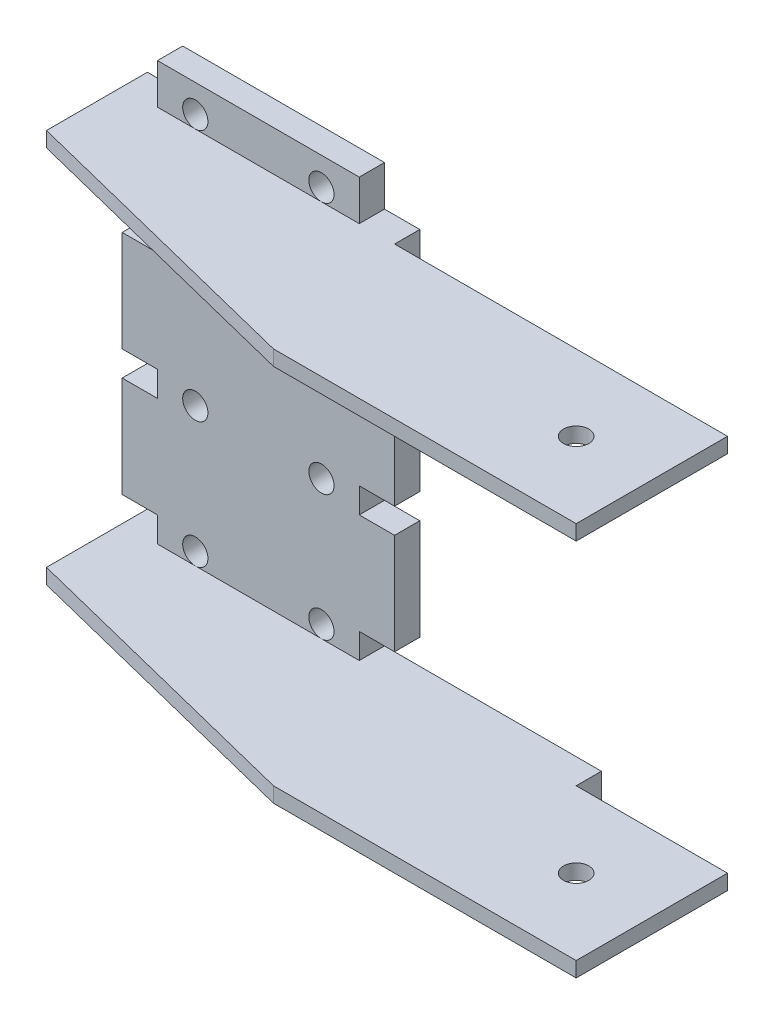
from build123d import *

# Parameters (mm, degrees)
SKETCH1_R           = 2.5
BOSS_EXTRUDE1_DEPTH = 5
SKETCH2_W           = 3
SKETCH2_H           = 70
CUT_EXTRUDE3_DEPTH  = 10
SKETCH7_W           = 3
SKETCH7_H           = 5
BOSS_EXTRUDE5_DEPTH = 7
SKETCH8_R           = 0.5
CUT_EXTRUDE5_DEPTH  = 40
SKETCH9_W           = 120
SKETCH9_H           = 3
BOSS_EXTRUDE6_DEPTH = 30
SKETCH10_R          = 2.5
CUT_EXTRUDE6_DEPTH  = 100


with BuildPart() as part:
    # Sketch1 → Boss-Extrude1 (new body)
    with BuildSketch(Plane.XY):
        Polygon((-50, 20), (-60, 20), (-60, 0), (-50, 0), (-50, -5), (-60, -5), (-60, -25), (-50, -25), (-50, -30), (-60, -30), (-60, -50), (-50, -50), (-50, -55), (-57, -55), (-57, -65), (-32, -65), (-32, -75), (33, -60), (33, -55), (-10, -55), (-10, -50), (0, -50), (0, -30), (-10, -30), (-10, -25), (0, -25), (0, -5), (-10, -5), (-10, 0), (0, 0), (0, 20), (-10, 20), (-10, 28), (-50, 28), align=None)
        with Locations((-42.5, 22.5)):
            Circle(SKETCH1_R, mode=Mode.SUBTRACT)
        with Locations((-17.5, 22.5)):
            Circle(SKETCH1_R, mode=Mode.SUBTRACT)
        with Locations((-42.5, -2.5)):
            Circle(SKETCH1_R, mode=Mode.SUBTRACT)
        with Locations((-17.5, -2.5)):
            Circle(SKETCH1_R, mode=Mode.SUBTRACT)
        with Locations((-17.5, -27.5)):
            Circle(SKETCH1_R, mode=Mode.SUBTRACT)
        with Locations((-42.5, -27.5)):
            Circle(SKETCH1_R, mode=Mode.SUBTRACT)
        with Locations((-17.5, -52.5)):
            Circle(SKETCH1_R, mode=Mode.SUBTRACT)
        with Locations((-42.5, -52.5)):
            Circle(SKETCH1_R, mode=Mode.SUBTRACT)
    extrude(amount=BOSS_EXTRUDE1_DEPTH)

    # Sketch2 → Cut-Extrude3 (cut)
    with BuildSketch(Plane(origin=(0, 0, 0), x_dir=(-1, 0, 0), z_dir=(0, 0, -1))):
        with Locations((58.5, -15)):
            Rectangle(SKETCH2_W, SKETCH2_H)
        with Locations((1.5, -15)):
            Rectangle(SKETCH2_W, SKETCH2_H)
    extrude(amount=-CUT_EXTRUDE3_DEPTH, mode=Mode.SUBTRACT)

    # Sketch7 → Boss-Extrude5 (add)
    with BuildSketch(Plane(origin=(14.814606742, -64.196629213, 0), x_dir=(0.97439119569462, 0.22485950669875845, 0), z_dir=(0.22485950669875845, -0.97439119569462, 0))):
        with Locations((-46.544981265, 2.5)):
            Rectangle(SKETCH7_W, SKETCH7_H)
        with Locations((-13.544981265, 2.5)):
            Rectangle(SKETCH7_W, SKETCH7_H)
    extrude(amount=BOSS_EXTRUDE5_DEPTH)

    # Sketch8 → Cut-Extrude5 (cut)
    with BuildSketch(Plane(origin=(-46.814606742, -10.803370787, 0), x_dir=(0, 0, 1), z_dir=(-0.97439119569462, -0.22485950669875848, 0))):
        with Locations((2.5, -70.383835463)):
            Circle(SKETCH8_R)
    extrude(amount=-CUT_EXTRUDE5_DEPTH, mode=Mode.SUBTRACT)

    # Sketch9 → Boss-Extrude6 (add)
    with BuildSketch(Plane.XY.offset(5)):
        with Locations((3, -56.5)):
            Rectangle(SKETCH9_W, SKETCH9_H)
        with Locations((3, 18.5)):
            Rectangle(SKETCH9_W, SKETCH9_H)
    extrude(amount=BOSS_EXTRUDE6_DEPTH)

    # Sketch10 → Cut-Extrude6 (cut)
    with BuildSketch(Plane.XZ.offset(58)):
        with Locations((48, 20)):
            Circle(SKETCH10_R)
        Polygon((-57, 20), (3, 35), (-57, 35), align=None)
    extrude(amount=-CUT_EXTRUDE6_DEPTH, mode=Mode.SUBTRACT)


solid = part.part
